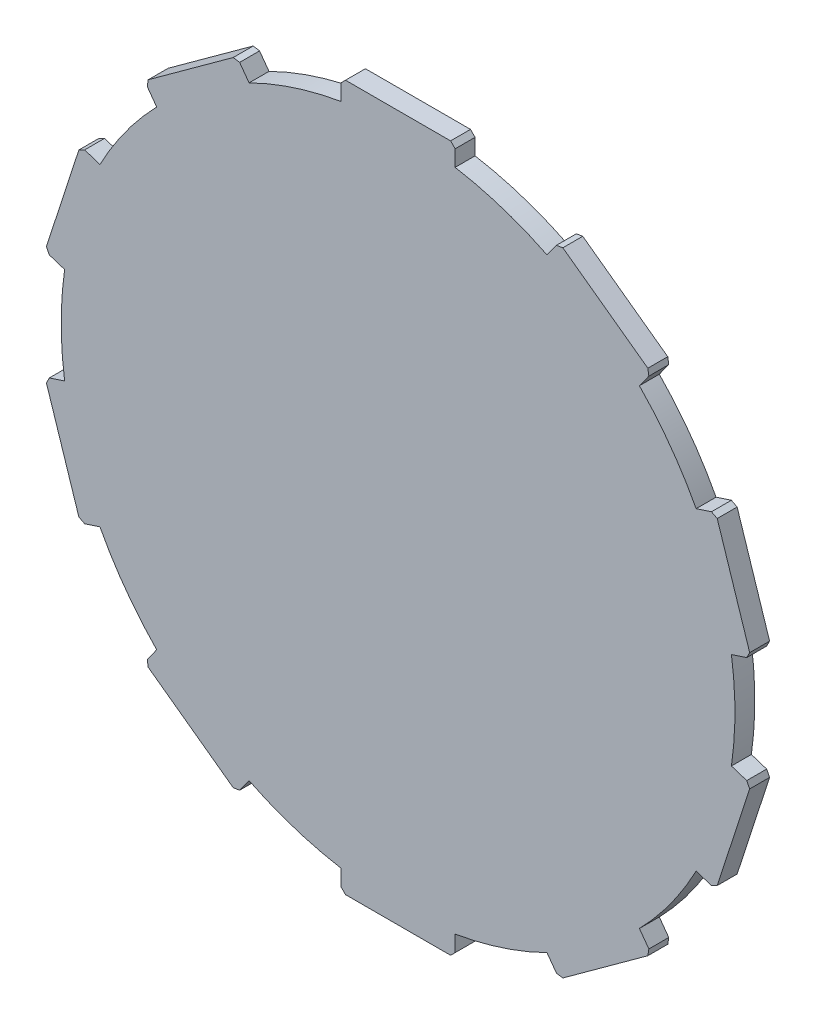
from build123d import *

# Parameters (mm, degrees)
BOSS_EXTRUDE1_DEPTH = 3


with BuildPart() as part:
    # Base_Sketch → Boss-Extrude1 (new body)
    with BuildSketch(Plane.XY):
        with BuildLine():
            Line((-8.603981625, 52.439957176), (-8.603981625, 50.01533765))
            ThreePointArc((-8.603981625, 50.01533765), (-15.682612465, 48.266118202), (-22.437510505, 45.520551648))
            Line((-22.437510505, 45.520551648), (-23.862666105, 47.48211005))
            Line((-23.862666105, 47.48211005), (-24.825537526, 47.634613901))
            Line((-24.825537526, 47.634613901), (-37.631696962, 38.33039445))
            Line((-37.631696962, 38.33039445), (-37.784200813, 37.36752303))
            Line((-37.784200813, 37.36752303), (-36.359045213, 35.405964628))
            ThreePointArc((-36.359045213, 35.405964628), (-41.057612465, 29.830101554), (-44.908636245, 23.638462104))
            Line((-44.908636245, 23.638462104), (-47.214586445, 24.387710742))
            Line((-47.214586445, 24.387710742), (-48.083205302, 23.945127328))
            Line((-48.083205302, 23.945127328), (-52.974722942, 8.890584019))
            Line((-52.974722942, 8.890584019), (-52.532139528, 8.021965161))
            Line((-52.532139528, 8.021965161), (-50.226189328, 7.272716523))
            ThreePointArc((-50.226189328, 7.272716523), (-50.75, 0), (-50.226189328, -7.272716523))
            Line((-50.226189328, -7.272716523), (-52.532139528, -8.021965161))
            Line((-52.532139528, -8.021965161), (-52.974722942, -8.890584019))
            Line((-52.974722942, -8.890584019), (-48.083205302, -23.945127328))
            Line((-48.083205302, -23.945127328), (-47.214586445, -24.387710742))
            Line((-47.214586445, -24.387710742), (-44.908636245, -23.638462104))
            ThreePointArc((-44.908636245, -23.638462104), (-41.057612465, -29.830101554), (-36.359045213, -35.405964628))
            Line((-36.359045213, -35.405964628), (-37.784200813, -37.36752303))
            Line((-37.784200813, -37.36752303), (-37.631696962, -38.33039445))
            Line((-37.631696962, -38.33039445), (-24.825537526, -47.634613901))
            Line((-24.825537526, -47.634613901), (-23.862666105, -47.48211005))
            Line((-23.862666105, -47.48211005), (-22.437510505, -45.520551648))
            ThreePointArc((-22.437510505, -45.520551648), (-15.682612465, -48.266118202), (-8.603981625, -50.01533765))
            Line((-8.603981625, -50.01533765), (-8.603981625, -52.439957176))
            Line((-8.603981625, -52.439957176), (-7.914641797, -53.129297004))
            Line((-7.914641797, -53.129297004), (7.914641797, -53.129297004))
            Line((7.914641797, -53.129297004), (8.603981625, -52.439957176))
            Line((8.603981625, -52.439957176), (8.603981625, -50.01533765))
            ThreePointArc((8.603981625, -50.01533765), (15.682612465, -48.266118202), (22.437510505, -45.520551648))
            Line((22.437510505, -45.520551648), (23.862666105, -47.48211005))
            Line((23.862666105, -47.48211005), (24.825537526, -47.634613901))
            Line((24.825537526, -47.634613901), (37.631696962, -38.33039445))
            Line((37.631696962, -38.33039445), (37.784200813, -37.36752303))
            Line((37.784200813, -37.36752303), (36.359045213, -35.405964628))
            ThreePointArc((36.359045213, -35.405964628), (41.057612465, -29.830101554), (44.908636245, -23.638462104))
            Line((44.908636245, -23.638462104), (47.214586445, -24.387710742))
            Line((47.214586445, -24.387710742), (48.083205302, -23.945127328))
            Line((48.083205302, -23.945127328), (52.974722942, -8.890584019))
            Line((52.974722942, -8.890584019), (52.532139528, -8.021965161))
            Line((52.532139528, -8.021965161), (50.226189328, -7.272716523))
            ThreePointArc((50.226189328, -7.272716523), (50.75, 0), (50.226189328, 7.272716523))
            Line((50.226189328, 7.272716523), (52.532139528, 8.021965161))
            Line((52.532139528, 8.021965161), (52.974722942, 8.890584019))
            Line((52.974722942, 8.890584019), (48.083205302, 23.945127328))
            Line((48.083205302, 23.945127328), (47.214586445, 24.387710742))
            Line((47.214586445, 24.387710742), (44.908636245, 23.638462104))
            ThreePointArc((44.908636245, 23.638462104), (41.057612465, 29.830101554), (36.359045213, 35.405964628))
            Line((36.359045213, 35.405964628), (37.784200813, 37.36752303))
            Line((37.784200813, 37.36752303), (37.631696962, 38.33039445))
            Line((37.631696962, 38.33039445), (24.825537526, 47.634613901))
            Line((24.825537526, 47.634613901), (23.862666105, 47.48211005))
            Line((23.862666105, 47.48211005), (22.437510505, 45.520551648))
            ThreePointArc((22.437510505, 45.520551648), (15.682612465, 48.266118202), (8.603981625, 50.01533765))
            Line((8.603981625, 50.01533765), (8.603981625, 52.439957176))
            Line((8.603981625, 52.439957176), (7.914641797, 53.129297004))
            Line((7.914641797, 53.129297004), (-7.914641797, 53.129297004))
            Line((-7.914641797, 53.129297004), (-8.603981625, 52.439957176))
        make_face()
    extrude(amount=BOSS_EXTRUDE1_DEPTH)


solid = part.part
